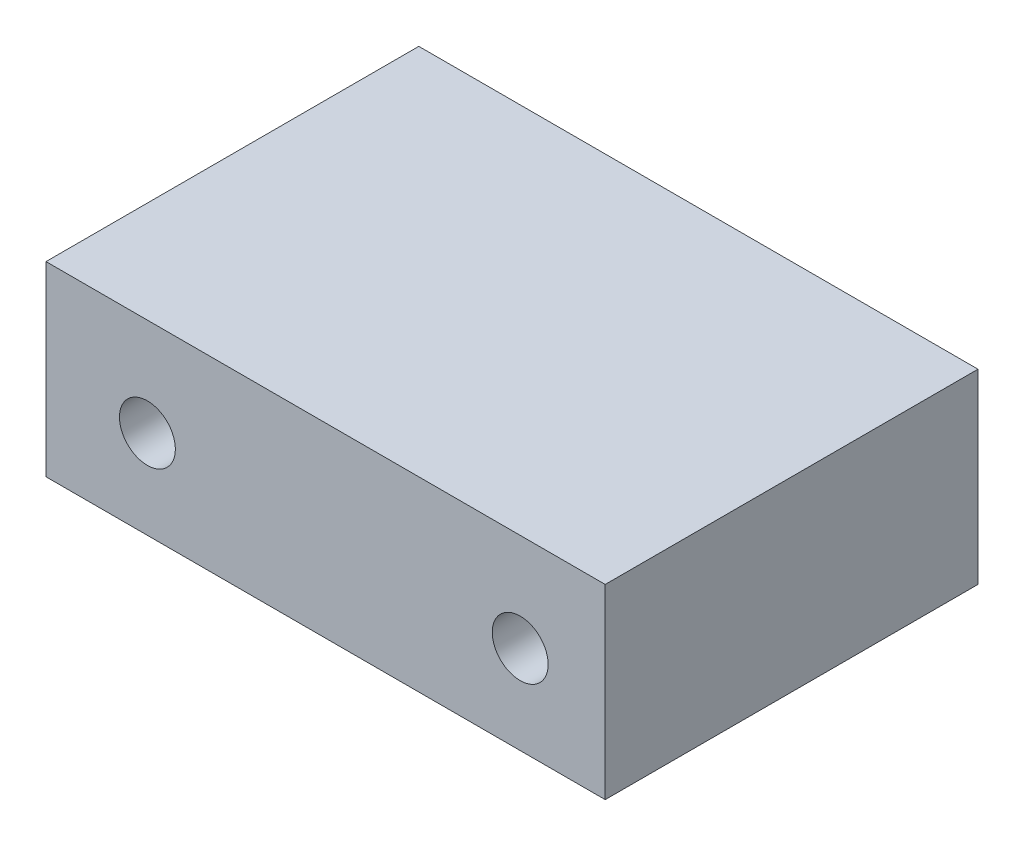
from build123d import *

# Parameters (mm, degrees)
SKETCH_1_W          = 30
SKETCH_1_H          = 20
EXTRUDE_1_DEPTH     = 10
SKETCH_2_R          = 1.5
CUT_EXTRUDE_1_DEPTH = 25


with BuildPart() as part:
    # 草图1 → 凸台-拉伸1 (new body)
    with BuildSketch(Plane(origin=(0, 0, 0), x_dir=(1, 0, 0), z_dir=(0, 1, 0))):
        Rectangle(SKETCH_1_W, SKETCH_1_H)
    extrude(amount=EXTRUDE_1_DEPTH)

    # 草图2 → 切除-拉伸1 (cut)
    with BuildSketch(Plane.XY.offset(10)):
        with Locations((-9.560103169, 4.75)):
            Circle(SKETCH_2_R)
        with Locations((10.439896831, 4.75)):
            Circle(SKETCH_2_R)
    extrude(amount=-CUT_EXTRUDE_1_DEPTH, mode=Mode.SUBTRACT)


solid = part.part
